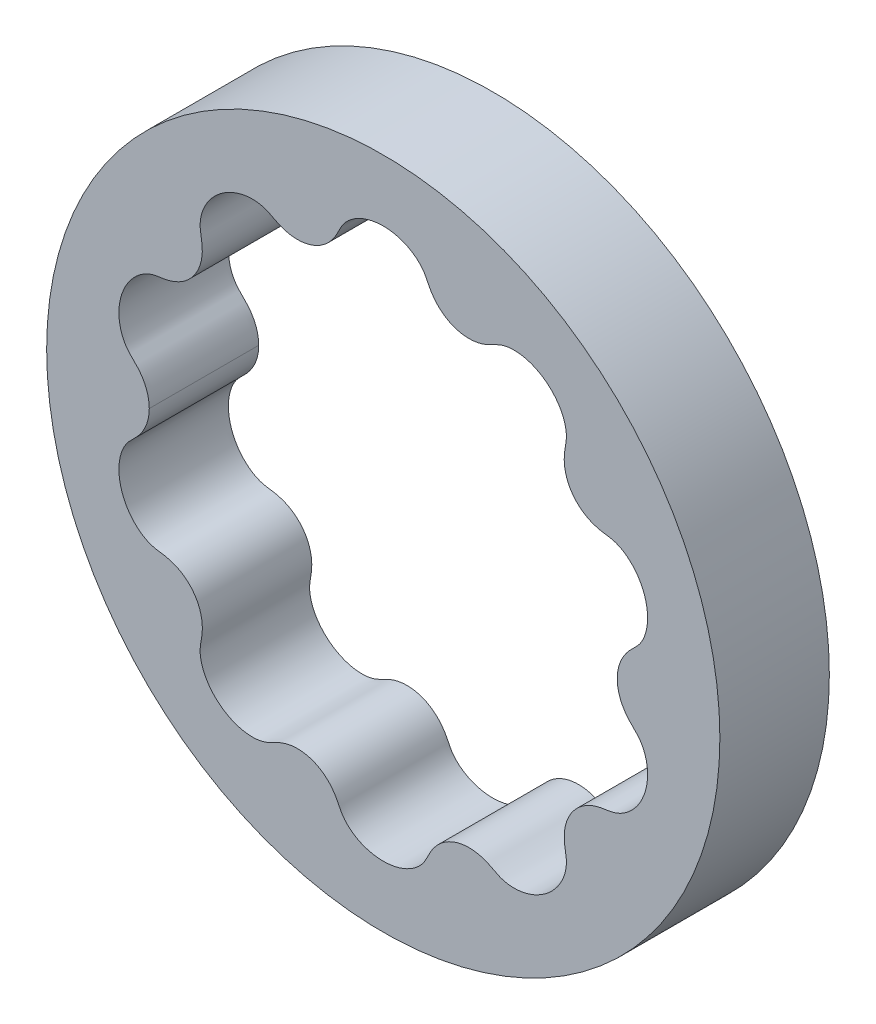
from build123d import *

# Parameters (mm, degrees)
ESQUISSE1_R        = 12.3
BOSS_EXTRU_4_DEPTH = 4


with BuildPart() as part:
    # Esquisse1 → Boss.-Extru.4 (new body)
    with BuildSketch(Plane.XY):
        Circle(ESQUISSE1_R)
        with BuildLine():
            add(Edge.make_bspline(
                [(8.55, 0), (8.55, -0.016588815), (8.550616021, -0.049912383), (8.553388112, -0.107923301), (8.560769692, -0.189983051), (8.577537241, -0.307591931), (8.612526338, -0.456111205), (8.672741994, -0.628375918), (8.76564286, -0.808904864), (8.87006122, -0.966252078), (8.979209546, -1.09969991), (9.092040287, -1.216259213), (9.202814775, -1.319830831), (9.301508749, -1.421110011), (9.382810318, -1.524022055), (9.469787809, -1.661896449), (9.552477915, -1.838583302), (9.635112865, -2.106115511), (9.676495666, -2.469399854), (9.639303297, -2.881297954), (9.497997659, -3.319252643), (9.293157648, -3.668693971), (9.062171204, -3.93010568), (8.833326901, -4.112316462), (8.628297524, -4.229915985), (8.421222904, -4.308116079), (8.219557147, -4.342360519), (7.980227561, -4.371485586), (7.689887808, -4.439028885), (7.355782145, -4.587537747), (7.021095749, -4.858539203), (6.796467157, -5.179636221), (6.673845718, -5.488796094), (6.613308252, -5.791788242), (6.604391338, -6.036243691), (6.628540244, -6.269031725), (6.674349886, -6.497719081), (6.699706931, -6.69528508), (6.687030336, -6.914797127), (6.635592148, -7.148334743), (6.529100967, -7.422734236), (6.347787021, -7.721598099), (6.079840913, -8.016797116), (5.716879833, -8.276708896), (5.350010045, -8.434652761), (5.007313403, -8.508191642), (4.711096433, -8.518617682), (4.471164557, -8.489759059), (4.209620051, -8.412598402), (3.953215604, -8.256894235), (3.630056826, -8.112064371), (3.226552964, -8.033146041), (2.797251171, -8.062647098), (2.42725953, -8.197974156), (2.149395076, -8.381481875), (1.958937442, -8.563706156), (1.833265187, -8.717795364), (1.730557821, -8.876241038), (1.646622771, -9.034068392), (1.568436238, -9.205552726), (1.468488201, -9.377525439), (1.327420408, -9.542712546), (1.149667233, -9.695467338), (0.9048198, -9.84962975), (0.586324939, -9.980871999), (0.202620532, -10.059243462), (-0.234841003, -10.055792774), (-0.614230893, -9.972056686), (-0.925125906, -9.838724654), (-1.163218836, -9.684903686), (-1.335496634, -9.534254608), (-1.473381482, -9.370590812), (-1.571599243, -9.198794083), (-1.649512008, -9.028097233), (-1.733624637, -8.87107032), (-1.836375481, -8.713601567), (-1.96189581, -8.56060206), (-2.151740269, -8.379810434), (-2.42877033, -8.197390757), (-2.797900426, -8.062602382), (-3.226552888, -8.033146106), (-3.630056879, -8.112064327), (-3.953215571, -8.256894262), (-4.209620067, -8.412598389), (-4.471164548, -8.489759066), (-4.711096437, -8.518617678), (-5.0073134, -8.508191645), (-5.350010047, -8.434652759), (-5.716879832, -8.276708898), (-6.079840914, -8.016797115), (-6.34778702, -7.7215981), (-6.529100967, -7.422734235), (-6.635592148, -7.148334743), (-6.687030335, -6.914797127), (-6.699706931, -6.695285081), (-6.674349885, -6.49771908), (-6.628540246, -6.269031728), (-6.604391334, -6.036243686), (-6.613308257, -5.791788249), (-6.673845711, -5.488796084), (-6.796467171, -5.17963624), (-7.021095725, -4.858539172), (-7.355782181, -4.587537795), (-7.68988775, -4.439028809), (-7.980227667, -4.371485725), (-8.219556949, -4.342360259), (-8.42122326, -4.308116547), (-8.628296912, -4.229915183), (-8.833327858, -4.112317716), (-9.062169432, -3.930103358), (-9.2931611, -3.668698496), (-9.497991772, -3.319244924), (-9.639312348, -2.881309822), (-9.682333124, -2.404547792), (-9.61976149, -2.008986787), (-9.504298945, -1.716596539), (-9.382803227, -1.524013121), (-9.301511533, -1.421111697), (-9.202813872, -1.319838115), (-9.092040563, -1.216227157), (-8.979209386, -1.099785556), (-8.870061411, -0.966080219), (-8.765642553, -0.809211848), (-8.686136707, -0.653920758), (-8.628773164, -0.503189025), (-8.592729245, -0.371603732), (-8.573295384, -0.278037955), (-8.560769661, -0.190015074), (-8.553388118, -0.107917163), (-8.550616021, -0.04991167), (-8.55, -0.016588815), (-8.55, 0)],
                knots=[0.066026483, 0.066026483, 0.066026483, 0.066026483, 0.066026483, 0.06795645, 0.069886416, 0.071816383, 0.073746349, 0.07967542, 0.085604492, 0.089956251, 0.09430801, 0.09865977, 0.103011529, 0.106316371, 0.109621212, 0.112926054, 0.116230895, 0.122745874, 0.129260852, 0.141084892, 0.152908933, 0.164138516, 0.175368099, 0.181653804, 0.18793951, 0.193552902, 0.199166294, 0.203851639, 0.208536985, 0.217907676, 0.229156266, 0.24040291, 0.25144711, 0.2569695, 0.262491889, 0.271512179, 0.276022324, 0.28053247, 0.286048675, 0.29156488, 0.298085233, 0.304605585, 0.315639713, 0.326673841, 0.338020122, 0.349366403, 0.355624327, 0.36188225, 0.367803393, 0.373724536, 0.382887947, 0.392051358, 0.403412101, 0.414778415, 0.425786447, 0.431294883, 0.43680332, 0.441312316, 0.445821313, 0.450330309, 0.454839305, 0.460338395, 0.465837485, 0.472137108, 0.478436731, 0.489437745, 0.500438759, 0.511372665, 0.522306571, 0.528363683, 0.534420795, 0.539886625, 0.545352454, 0.549845309, 0.554338164, 0.558831019, 0.563323873, 0.568801147, 0.57427842, 0.585221585, 0.596587899, 0.607948642, 0.617112053, 0.626275464, 0.632196607, 0.63811775, 0.644375673, 0.650633597, 0.661979878, 0.673326159, 0.684360287, 0.695394415, 0.701914767, 0.70843512, 0.713951325, 0.71946753, 0.723977676, 0.728487821, 0.737508111, 0.7430305, 0.74855289, 0.75959709, 0.770843734, 0.782092324, 0.791463015, 0.796148361, 0.800833706, 0.806447098, 0.81206049, 0.818346196, 0.824631901, 0.835861484, 0.847091067, 0.858915108, 0.870739148, 0.883769105, 0.887073946, 0.890378788, 0.893683629, 0.896988471, 0.90134023, 0.90569199, 0.910043749, 0.914395508, 0.92032458, 0.923289115, 0.926253651, 0.928183617, 0.930113584, 0.93204355, 0.933973517, 0.933973517, 0.933973517, 0.933973517, 0.933973517], degree=4))
            add(Edge.make_bspline(
                [(8.55, 0), (8.55, 0.016588815), (8.550616021, 0.049912383), (8.553388112, 0.107923301), (8.560769692, 0.18998305), (8.577537241, 0.30759193), (8.612526338, 0.456111205), (8.672741994, 0.628375918), (8.76564286, 0.808904864), (8.87006122, 0.966252078), (8.979209546, 1.09969991), (9.092040287, 1.216259213), (9.202814775, 1.319830831), (9.301508749, 1.421110011), (9.382810318, 1.524022054), (9.469787809, 1.661896449), (9.552477915, 1.838583302), (9.635112865, 2.106115511), (9.676495666, 2.469399854), (9.639303297, 2.881297954), (9.497997659, 3.319252643), (9.293157648, 3.668693971), (9.062171204, 3.93010568), (8.833326902, 4.112316462), (8.628297524, 4.229915985), (8.421222904, 4.308116079), (8.219557147, 4.342360519), (7.980227561, 4.371485586), (7.689887808, 4.439028885), (7.355782145, 4.587537747), (7.021095749, 4.858539203), (6.796467157, 5.179636221), (6.673845718, 5.488796094), (6.613308252, 5.791788242), (6.604391338, 6.036243691), (6.628540244, 6.269031725), (6.674349886, 6.497719081), (6.699706931, 6.69528508), (6.687030336, 6.914797127), (6.635592148, 7.148334743), (6.529100967, 7.422734236), (6.347787021, 7.721598099), (6.079840913, 8.016797115), (5.716879833, 8.276708896), (5.350010045, 8.434652761), (5.007313403, 8.508191642), (4.711096433, 8.518617682), (4.471164557, 8.489759059), (4.209620051, 8.412598402), (3.953215604, 8.256894235), (3.630056826, 8.112064371), (3.226552964, 8.033146041), (2.797251171, 8.062647098), (2.42725953, 8.197974156), (2.149395076, 8.381481875), (1.958937442, 8.563706156), (1.833265187, 8.717795364), (1.730557821, 8.876241038), (1.646622771, 9.034068392), (1.568436238, 9.205552726), (1.468488201, 9.377525439), (1.327420408, 9.542712546), (1.149667233, 9.695467338), (0.9048198, 9.84962975), (0.586324939, 9.980871999), (0.202620532, 10.059243462), (-0.234841003, 10.055792774), (-0.614230893, 9.972056686), (-0.925125906, 9.838724654), (-1.163218836, 9.684903686), (-1.335496634, 9.534254608), (-1.473381482, 9.370590812), (-1.571599243, 9.198794083), (-1.649512007, 9.028097233), (-1.733624637, 8.87107032), (-1.836375481, 8.713601567), (-1.96189581, 8.56060206), (-2.151740269, 8.379810434), (-2.42877033, 8.197390757), (-2.797900426, 8.062602382), (-3.226552888, 8.033146106), (-3.630056879, 8.112064327), (-3.953215571, 8.256894262), (-4.209620067, 8.412598389), (-4.471164548, 8.489759066), (-4.711096437, 8.518617678), (-5.0073134, 8.508191645), (-5.350010047, 8.434652759), (-5.716879832, 8.276708898), (-6.079840914, 8.016797115), (-6.34778702, 7.7215981), (-6.529100967, 7.422734235), (-6.635592148, 7.148334743), (-6.687030335, 6.914797127), (-6.699706931, 6.695285081), (-6.674349885, 6.49771908), (-6.628540246, 6.269031728), (-6.604391334, 6.036243686), (-6.613308257, 5.791788249), (-6.673845711, 5.488796084), (-6.796467171, 5.17963624), (-7.021095725, 4.858539172), (-7.355782181, 4.587537795), (-7.68988775, 4.439028809), (-7.980227667, 4.371485725), (-8.219556949, 4.342360259), (-8.42122326, 4.308116547), (-8.628296912, 4.229915183), (-8.833327858, 4.112317716), (-9.062169432, 3.930103357), (-9.2931611, 3.668698496), (-9.497991772, 3.319244924), (-9.639312348, 2.881309822), (-9.682333124, 2.404547792), (-9.61976149, 2.008986787), (-9.504298945, 1.716596539), (-9.382803227, 1.524013121), (-9.301511533, 1.421111697), (-9.202813872, 1.319838115), (-9.092040563, 1.216227157), (-8.979209386, 1.099785556), (-8.870061411, 0.966080219), (-8.765642553, 0.809211848), (-8.686136707, 0.653920758), (-8.628773164, 0.503189025), (-8.592729245, 0.371603732), (-8.573295384, 0.278037955), (-8.560769661, 0.190015074), (-8.553388118, 0.107917163), (-8.550616021, 0.04991167), (-8.55, 0.016588815), (-8.55, 0)],
                knots=[0.066026483, 0.066026483, 0.066026483, 0.066026483, 0.066026483, 0.06795645, 0.069886416, 0.071816383, 0.073746349, 0.07967542, 0.085604492, 0.089956251, 0.09430801, 0.09865977, 0.103011529, 0.106316371, 0.109621212, 0.112926054, 0.116230895, 0.122745874, 0.129260852, 0.141084892, 0.152908933, 0.164138516, 0.175368099, 0.181653804, 0.18793951, 0.193552902, 0.199166294, 0.203851639, 0.208536985, 0.217907676, 0.229156266, 0.24040291, 0.25144711, 0.2569695, 0.262491889, 0.271512179, 0.276022324, 0.28053247, 0.286048675, 0.29156488, 0.298085233, 0.304605585, 0.315639713, 0.326673841, 0.338020122, 0.349366403, 0.355624327, 0.36188225, 0.367803393, 0.373724536, 0.382887947, 0.392051358, 0.403412101, 0.414778415, 0.425786447, 0.431294883, 0.43680332, 0.441312316, 0.445821313, 0.450330309, 0.454839305, 0.460338395, 0.465837485, 0.472137108, 0.478436731, 0.489437745, 0.500438759, 0.511372665, 0.522306571, 0.528363683, 0.534420795, 0.539886625, 0.545352454, 0.549845309, 0.554338164, 0.558831019, 0.563323873, 0.568801147, 0.57427842, 0.585221585, 0.596587899, 0.607948642, 0.617112053, 0.626275464, 0.632196607, 0.63811775, 0.644375673, 0.650633597, 0.661979878, 0.673326159, 0.684360287, 0.695394415, 0.701914767, 0.70843512, 0.713951325, 0.71946753, 0.723977676, 0.728487821, 0.737508111, 0.7430305, 0.74855289, 0.75959709, 0.770843734, 0.782092324, 0.791463015, 0.796148361, 0.800833706, 0.806447098, 0.81206049, 0.818346196, 0.824631901, 0.835861484, 0.847091067, 0.858915108, 0.870739148, 0.883769105, 0.887073946, 0.890378788, 0.893683629, 0.896988471, 0.90134023, 0.90569199, 0.910043749, 0.914395508, 0.92032458, 0.923289115, 0.926253651, 0.928183617, 0.930113584, 0.93204355, 0.933973517, 0.933973517, 0.933973517, 0.933973517, 0.933973517], degree=4))
        make_face(mode=Mode.SUBTRACT)
    extrude(amount=BOSS_EXTRU_4_DEPTH)


solid = part.part
